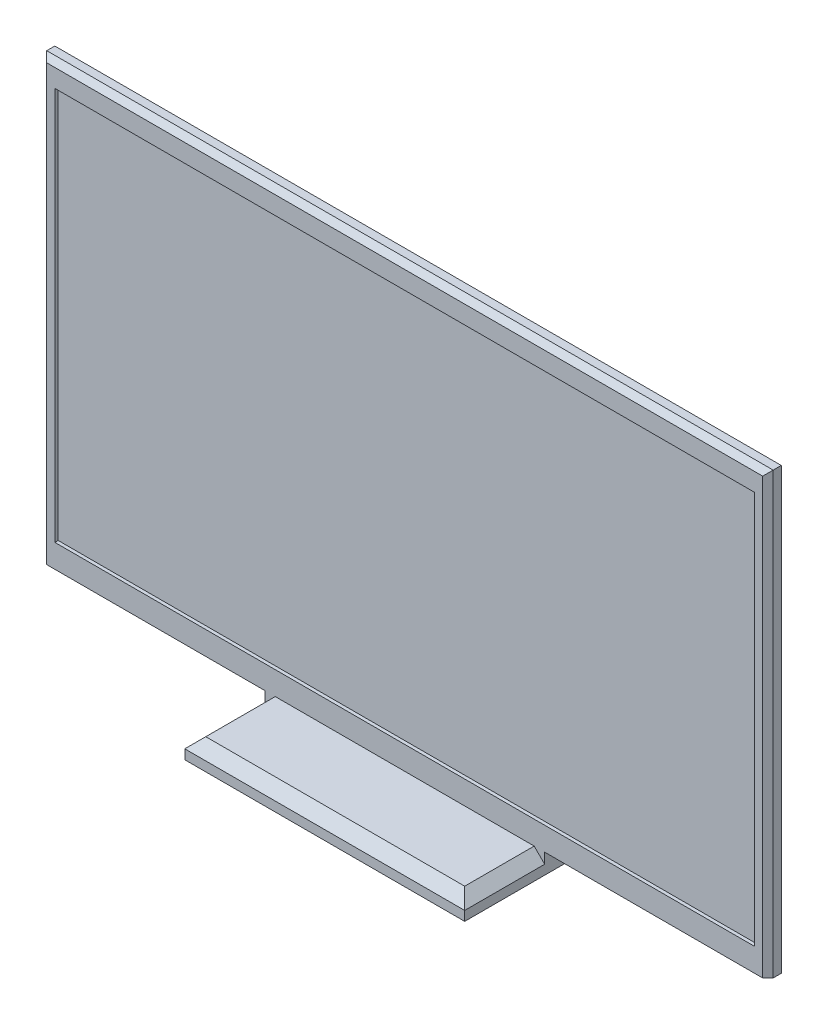
from build123d import *

# Parameters (mm, degrees)
SKETCH1_W           = 1384.3
SKETCH1_H           = 838.2
BOSS_EXTRUDE1_DEPTH = 25.4
CHAMFER1_SIZE       = 10
SKETCH2_W           = 1333.5
SKETCH2_H           = 749.3
CUT_EXTRUDE1_DEPTH  = 6.35
SKETCH3_W           = 533.4
SKETCH3_H           = 330.2
BOSS_EXTRUDE2_DEPTH = 38.1
CHAMFER2_SIZE       = 20


with BuildPart() as part:
    # Sketch1 → Boss-Extrude1 (new body)
    with BuildSketch(Plane.XY):
        Rectangle(SKETCH1_W, SKETCH1_H)
    extrude(amount=BOSS_EXTRUDE1_DEPTH)

    # Chamfer1
    chamfer1_edges = [part.edges().sort_by_distance(p)[0] for p in [
        (-692.15, 0, 25.4),
        (692.15, 0, 25.4),
        (0, 419.1, 25.4),
    ]]
    chamfer(chamfer1_edges, length=CHAMFER1_SIZE)

    # Sketch2 → Cut-Extrude1 (cut)
    with BuildSketch(Plane.XY.offset(25.4)):
        Rectangle(SKETCH2_W, SKETCH2_H)
    extrude(amount=-CUT_EXTRUDE1_DEPTH, mode=Mode.SUBTRACT)

    # Sketch3 → Boss-Extrude2 (add)
    with BuildSketch(Plane.XZ.offset(419.1)):
        with Locations((0, 12.7)):
            Rectangle(SKETCH3_W, SKETCH3_H)
    extrude(amount=BOSS_EXTRUDE2_DEPTH)

    # Chamfer2
    chamfer2_edges = [part.edges().sort_by_distance(p)[0] for p in [
        (266.7, -419.1, 101.6),
        (-266.7, -419.1, 101.6),
        (0, -419.1, 177.8),
    ]]
    chamfer(chamfer2_edges, length=CHAMFER2_SIZE)


solid = part.part
